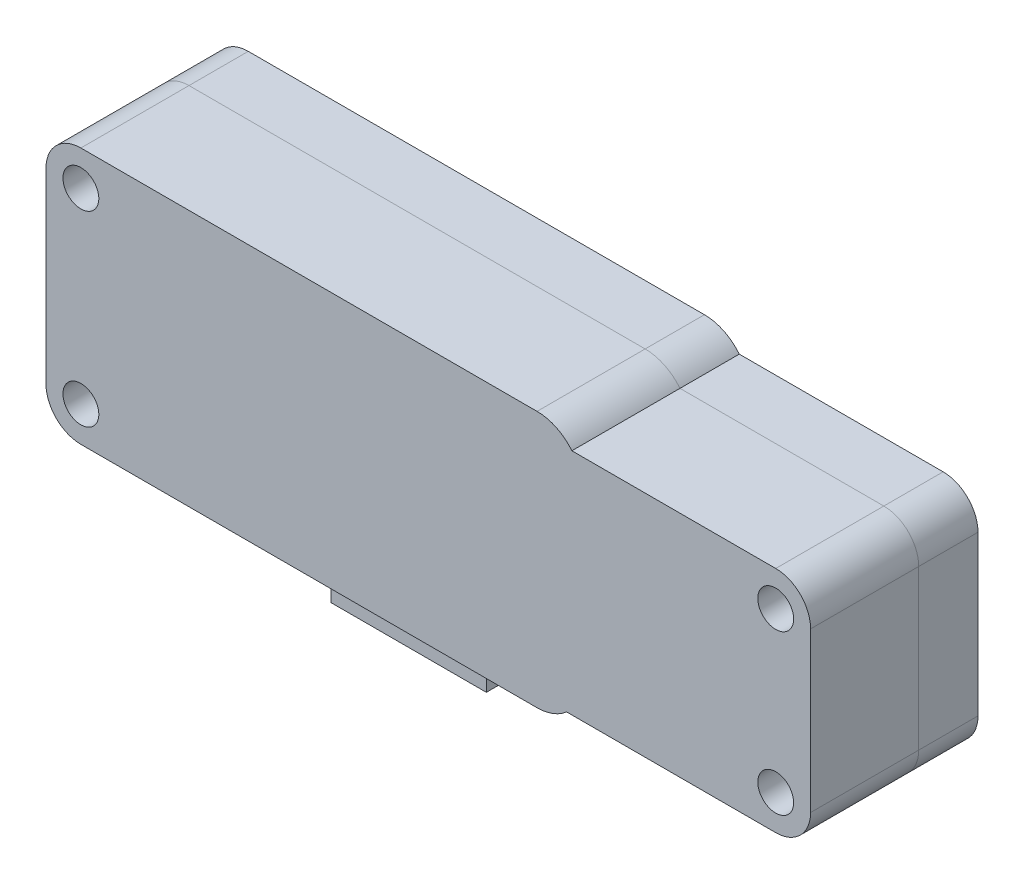
from build123d import *

# Parameters (mm, degrees)
BOSS_EXTRUDE1_START             = 0.508
BOSS_EXTRUDE1_DEPTH             = 12.7
BOSS_EXTRUDE2_DEPTH             = 3.27
BOSS_EXTRUDE2_DEPTH_BACK        = 3.27
SKETCH2_W                       = 14.14
SKETCH2_H                       = 7.9502
SKETCH3_W                       = 36.079999008
SKETCH3_H                       = 20.829999962
BOSS_EXTRUDE3_DEPTH             = 2.54
BOSS_EXTRUDE3_DIRECTION_2_REACH = 31.949
SKETCH7_W                       = 6.024
SKETCH7_H                       = 3.524
CUT_EXTRUDE1_DEPTH              = 2.54
BOSS_EXTRUDE5_DEPTH             = 12.7
F_4_CLEARANCE_HOLE4_D           = 3.2639
BOSS_EXTRUDE6_DEPTH             = 15.24
F_4_CLEARANCE_HOLE5_D           = 3.2639
SKETCH17_R                      = 1.63195
BOSS_EXTRUDE8_DEPTH             = 2.54


with BuildPart() as part:
    # Sketch1 → Boss-Extrude1 (new body)
    with BuildSketch(Plane.XY.offset(2.064).offset(BOSS_EXTRUDE1_START)):
        with BuildLine():
            Line((-21.844, 7.62), (-21.844, -7.62))
            ThreePointArc((-21.844, -7.62), (-20.653681959, -10.493681959), (-17.78, -11.684))
            Line((-17.78, -11.684), (17.78, -11.684))
            ThreePointArc((17.78, -11.684), (20.653681959, -10.493681959), (21.844, -7.62))
            Line((21.844, -7.62), (21.844, 7.62))
            ThreePointArc((21.844, 7.62), (20.653681959, 10.493681959), (17.78, 11.684))
            Line((17.78, 11.684), (-17.78, 11.684))
            ThreePointArc((-17.78, 11.684), (-20.653681959, 10.493681959), (-21.844, 7.62))
        make_face()
    extrude(amount=-BOSS_EXTRUDE1_DEPTH)

    # Sketch2 → Boss-Extrude2 (add, two sides: drawn at the far end of the back side and taken through both)
    with BuildSketch(Plane(origin=(0, 0, -4), x_dir=(-1, 0, 0), z_dir=(0, 0, -1)).offset(-BOSS_EXTRUDE2_DEPTH_BACK)):
        with Locations((-2.794, -12.10347265)):
            Rectangle(SKETCH2_W, SKETCH2_H)
    extrude(amount=BOSS_EXTRUDE2_DEPTH + BOSS_EXTRUDE2_DEPTH_BACK)

    # Sketch3 → Boss-Extrude3 (add)
    with BuildSketch(Plane(origin=(0, 0, -10.128), x_dir=(-1, 0, 0), z_dir=(0, 0, -1))):
        with Locations((-19.563999504, -0.253372669)):
            Rectangle(SKETCH3_W, SKETCH3_H)
    extrude(amount=BOSS_EXTRUDE3_DEPTH)

    # Boss-Extrude3 direction 2: up to this face of the body (flat: up to its plane)
    boss_extrude3_direction_2_end = Plane(part.part.faces().sort_by_distance((0, 0, 2.572))[0])
    # Sketch3 → Boss-Extrude3 direction 2 (add, up to the picked face)
    with BuildSketch(Plane(origin=(0, 0, -10.128), x_dir=(-1, 0, 0), z_dir=(0, 0, -1)), mode=Mode.PRIVATE) as boss_extrude3_direction_2_sk1:
        with Locations((-19.563999504, -0.253372669)):
            Rectangle(SKETCH3_W, SKETCH3_H)
    boss_extrude3_direction_2_tool1 = split(extrude(boss_extrude3_direction_2_sk1.sketch, amount=-BOSS_EXTRUDE3_DIRECTION_2_REACH, mode=Mode.PRIVATE), bisect_by=boss_extrude3_direction_2_end, keep=Keep.BOTH, mode=Mode.PRIVATE)
    add(boss_extrude3_direction_2_tool1.solids().sort_by(Axis((19.564, -0.253373, -10.128), (0, 0, 1)))[0])

    # Sketch7 → Cut-Extrude1 (cut)
    with BuildSketch(Plane.XZ.offset(16.07857265)):
        with Locations((2.794, -4)):
            Rectangle(SKETCH7_W, SKETCH7_H)
    extrude(amount=-CUT_EXTRUDE1_DEPTH, mode=Mode.SUBTRACT)

    # Sketch11 → Boss-Extrude5 (add, through all)
    with BuildSketch(Plane(origin=(0, 0, -10.128), x_dir=(-1, 0, 0), z_dir=(0, 0, -1))):
        with BuildLine():
            Line((17.78, 11.684), (23.749, 11.684))
            ThreePointArc((23.749, 11.684), (25.99406403, 10.75406403), (26.924, 8.509))
            Line((26.924, 8.509), (26.924, -8.509))
            ThreePointArc((26.924, -8.509), (25.99406403, -10.75406403), (23.749, -11.684))
            Line((23.749, -11.684), (17.78, -11.684))
            Line((17.78, -11.684), (-17.78, -11.684))
            ThreePointArc((-17.78, -11.684), (-19.216577452, -11.421623499), (-20.467660727, -10.66837265))
            Line((-20.467660727, -10.66837265), (-1.524, -10.66837265))
            Line((-1.524, -10.66837265), (-1.524, 10.161627312))
            Line((-1.524, 10.161627312), (-20.951155406, 10.161627312))
            ThreePointArc((-20.951155406, 10.161627312), (-19.538823841, 11.283691403), (-17.78, 11.684))
            Line((-17.78, 11.684), (17.78, 11.684))
        make_face()
    extrude(amount=-BOSS_EXTRUDE5_DEPTH)

    # #4 Clearance Hole4 (through all)
    with Locations(Plane(origin=(0, 0, -10.128), x_dir=(-1, 0, 0), z_dir=(0, 0, -1))):
        with Locations((23.749, 8.509), (23.749, -8.509)):
            Hole(F_4_CLEARANCE_HOLE4_D / 2)

    # Sketch14 → Boss-Extrude6 (add, through all)
    with BuildSketch(Plane(origin=(0, 0, -12.668), x_dir=(-1, 0, 0), z_dir=(0, 0, -1))):
        with BuildLine():
            Line((-37.603999008, 10.161627312), (-39.508999008, 10.161627312))
            ThreePointArc((-39.508999008, 10.161627312), (-41.754063038, 9.231691342), (-42.683999008, 6.986627312))
            Line((-42.683999008, 6.986627312), (-42.683999008, -7.49337265))
            ThreePointArc((-42.683999008, -7.49337265), (-41.754063038, -9.73843668), (-39.508999008, -10.66837265))
            Line((-39.508999008, -10.66837265), (-37.603999008, -10.66837265))
            Line((-37.603999008, -10.66837265), (-37.603999008, 10.161627312))
        make_face()
    extrude(amount=-BOSS_EXTRUDE6_DEPTH)

    # #4 Clearance Hole5 (through all)
    with Locations(Plane(origin=(0, 0, -12.668), x_dir=(-1, 0, 0), z_dir=(0, 0, -1))):
        with Locations((-39.508999008, 6.986627312), (-39.508999008, -7.49337265)):
            Hole(F_4_CLEARANCE_HOLE5_D / 2)

    # Sketch17 → Boss-Extrude8 (add)
    with BuildSketch(Plane(origin=(0, 0, -10.128), x_dir=(-1, 0, 0), z_dir=(0, 0, -1))):
        with BuildLine():
            Line((-17.78, -11.684), (23.749, -11.684))
            ThreePointArc((23.749, -11.684), (25.99406403, -10.75406403), (26.924, -8.509))
            Line((26.924, -8.509), (26.924, 8.509))
            ThreePointArc((26.924, 8.509), (25.99406403, 10.75406403), (23.749, 11.684))
            Line((23.749, 11.684), (-17.78, 11.684))
            ThreePointArc((-17.78, 11.684), (-19.538823841, 11.283691403), (-20.951155406, 10.161627312))
            Line((-20.951155406, 10.161627312), (-1.524, 10.161627312))
            Line((-1.524, 10.161627312), (-1.524, -10.66837265))
            Line((-1.524, -10.66837265), (-20.467660727, -10.66837265))
            ThreePointArc((-20.467660727, -10.66837265), (-19.216577452, -11.421623499), (-17.78, -11.684))
        make_face()
        with Locations((23.749, 8.509)):
            Circle(SKETCH17_R, mode=Mode.SUBTRACT)
        with Locations((23.749, -8.509)):
            Circle(SKETCH17_R, mode=Mode.SUBTRACT)
    extrude(amount=BOSS_EXTRUDE8_DEPTH)


with BuildPart() as body_2:
    # Split1: the piece on the far side of the plane
    add(part.part)
    split(bisect_by=Plane(origin=(0, 0, -7.27), x_dir=(-1, 0, 0), z_dir=(0, 0, -1)), keep=Keep.BOTTOM)


with BuildPart() as part_1:
    add(part.part)

    # Split1
    split(bisect_by=Plane(origin=(0, 0, -7.27), x_dir=(-1, 0, 0), z_dir=(0, 0, -1)), keep=Keep.TOP)


solid = Compound([body_2.part, part_1.part])
